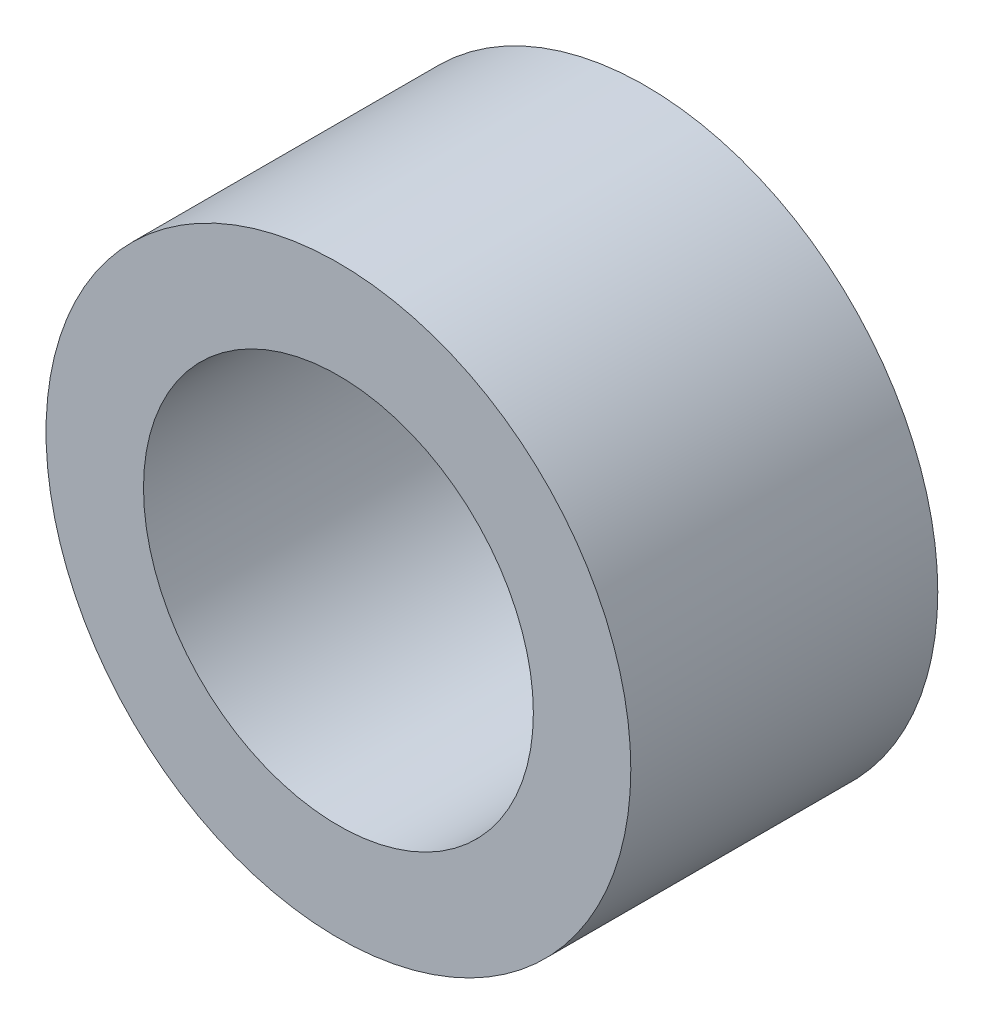
from build123d import *

# Parameters (mm, degrees)
ESQUISSE1_R        = 9.525
ESQUISSE1_R_2      = 6.35
BOSS_EXTRU_1_DEPTH = 10


with BuildPart() as part:
    # Esquisse1 → Boss.-Extru.1 (new body)
    with BuildSketch(Plane.XY):
        Circle(ESQUISSE1_R)
        Circle(ESQUISSE1_R_2, mode=Mode.SUBTRACT)
    extrude(amount=BOSS_EXTRU_1_DEPTH)


solid = part.part
